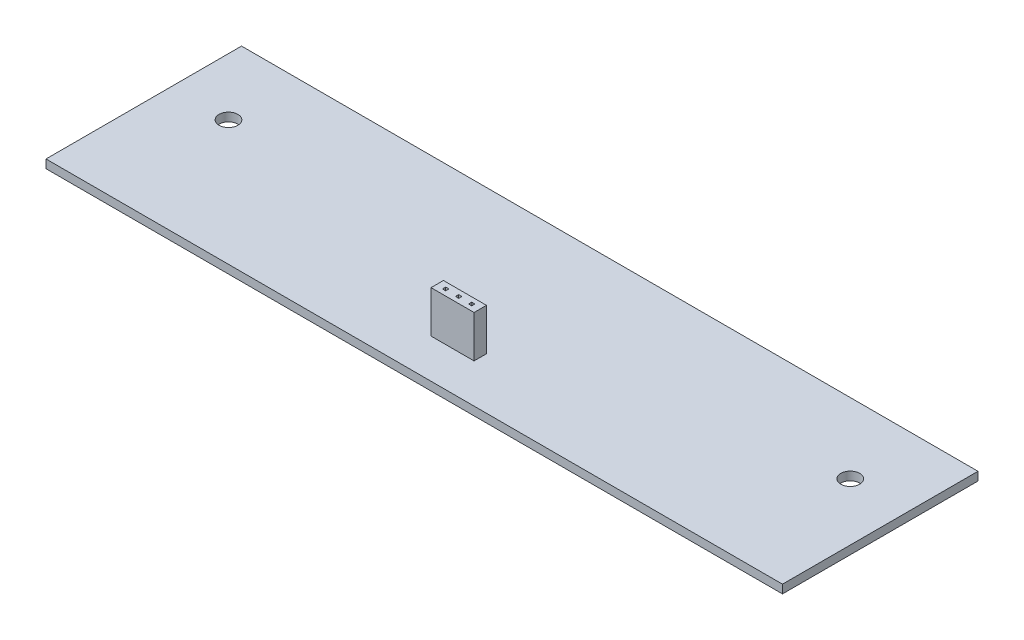
from build123d import *

# Parameters (mm, degrees)
ESQUISSE1_W             = 143.51
ESQUISSE1_H             = 38.1
BOSS_EXTRU_1_DEPTH      = 1.651
ESQUISSE2_R             = 1.8415
ENL_V_MAT_EXTRU_1_DEPTH = 75.259062248
ESQUISSE3_W             = 8.382
ESQUISSE3_H             = 2.413
BOSS_EXTRU_2_DEPTH      = 8.1788
ESQUISSE4_W             = 0.635
ESQUISSE4_H             = 0.635
ENL_V_MAT_EXTRU_2_DEPTH = 5.08


with BuildPart() as part:
    # Esquisse1 → Boss.-Extru.1 (new body)
    with BuildSketch(Plane(origin=(0, 0, 0), x_dir=(1, 0, 0), z_dir=(0, 1, 0))):
        Rectangle(ESQUISSE1_W, ESQUISSE1_H)
    extrude(amount=BOSS_EXTRU_1_DEPTH)

    # Esquisse2 → Enlèv. mat.-Extru.1 (cut, through all)
    with BuildSketch(Plane(origin=(0, 1.651, 0), x_dir=(1, 0, 0), z_dir=(0, 1, 0))):
        with Locations(Location((60.579, 5.334, 0), (0, 0, 270))):
            Circle(ESQUISSE2_R)
        with Locations(Location((-60.579, 5.334, 0), (0, 0, 270))):
            Circle(ESQUISSE2_R)
    extrude(amount=-ENL_V_MAT_EXTRU_1_DEPTH, mode=Mode.SUBTRACT)

    # Esquisse3 → Boss.-Extru.2 (add)
    with BuildSketch(Plane(origin=(0, 1.651, 0), x_dir=(1, 0, 0), z_dir=(0, 1, 0))):
        with Locations((-0.154698586, -10.2235)):
            Rectangle(ESQUISSE3_W, ESQUISSE3_H)
    extrude(amount=BOSS_EXTRU_2_DEPTH)

    # Esquisse4 → Enlèv. mat.-Extru.2 (cut)
    with BuildSketch(Plane(origin=(0, 9.8298, 0), x_dir=(1, 0, 0), z_dir=(0, 1, 0))):
        with Locations((-0.154698586, -10.2235)):
            Rectangle(ESQUISSE4_W, ESQUISSE4_H)
        with Locations((-2.694698586, -10.2235)):
            Rectangle(ESQUISSE4_W, ESQUISSE4_H)
        with Locations((2.385301414, -10.2235)):
            Rectangle(ESQUISSE4_W, ESQUISSE4_H)
    extrude(amount=-ENL_V_MAT_EXTRU_2_DEPTH, mode=Mode.SUBTRACT)


solid = part.part
